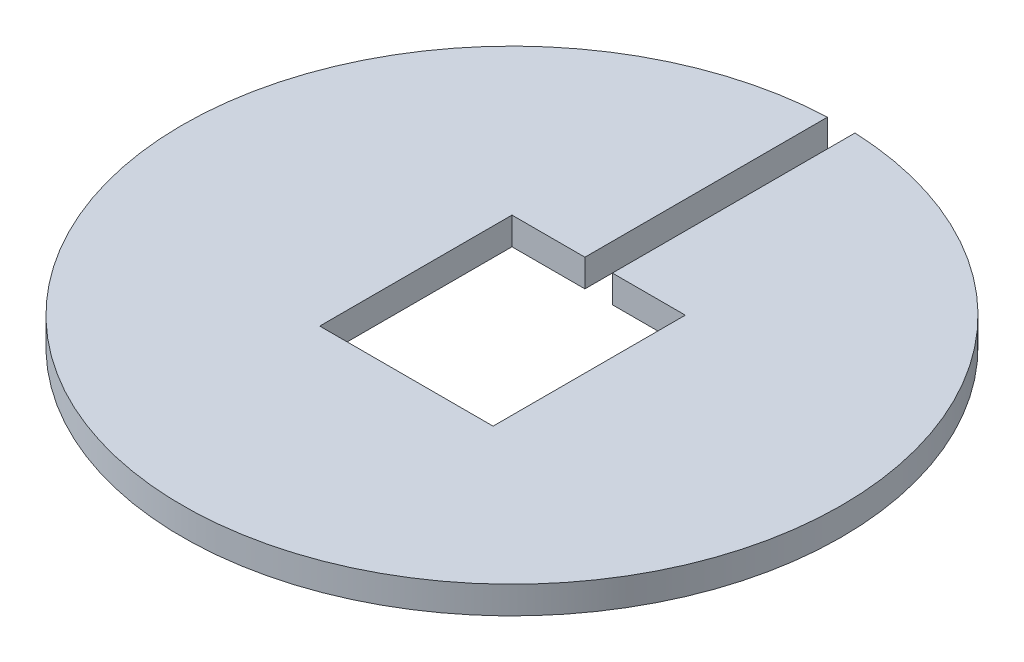
from build123d import *

# Parameters (mm, degrees)
BOSS_EXTRUDE1_DEPTH = 3.175


with BuildPart() as part:
    # Sketch1 → Boss-Extrude1 (new body)
    with BuildSketch(Plane(origin=(0, 0, 0), x_dir=(1, 0, 0), z_dir=(0, 1, 0))):
        with BuildLine():
            Line((-4.913547078, 7.761245518), (-4.913547078, 35.807858234))
            ThreePointArc((-4.913547078, 35.807858234), (-3.326047078, -40.359054482), (-1.738547078, 35.807858234))
            Line((-1.738547078, 35.807858234), (-1.738547078, 7.761245518))
            Line((-1.738547078, 7.761245518), (6.694252922, 7.761245518))
            Line((6.694252922, 7.761245518), (6.694252922, -14.463754482))
            Line((6.694252922, -14.463754482), (-13.346347078, -14.463754482))
            Line((-13.346347078, -14.463754482), (-13.346347078, 7.761245518))
            Line((-13.346347078, 7.761245518), (-4.913547078, 7.761245518))
        make_face()
    extrude(amount=BOSS_EXTRUDE1_DEPTH)


solid = part.part
